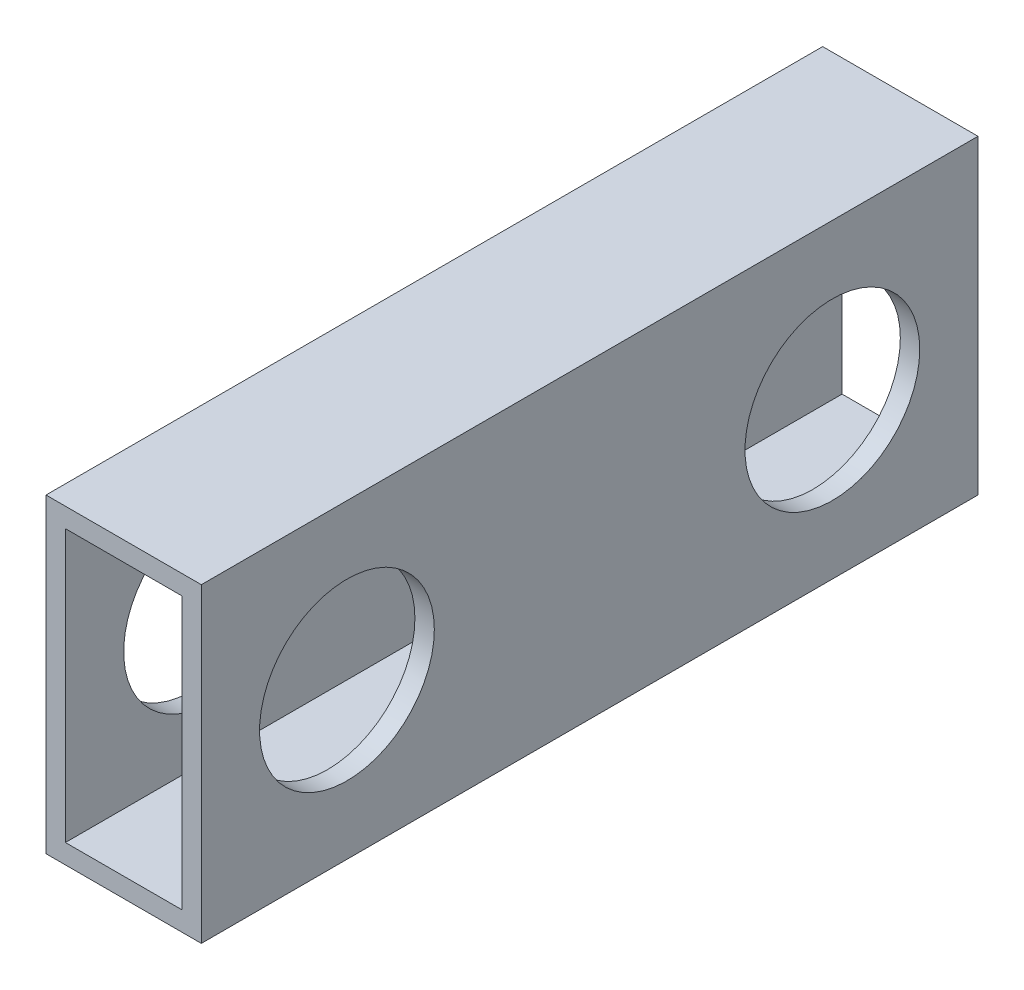
from build123d import *

# Parameters (mm, degrees)
SKETCH1_W           = 25.4
SKETCH1_H           = 50.8
BOSS_EXTRUDE1_DEPTH = 63.5
SHELL2_T            = -3.175
SKETCH2_R           = 14.2875
CUT_EXTRUDE1_DEPTH  = 73.955945611


with BuildPart() as part:
    # Sketch1 → Boss-Extrude1 (new, symmetric)
    with BuildSketch(Plane.XY):
        Rectangle(SKETCH1_W, SKETCH1_H)
    extrude(amount=BOSS_EXTRUDE1_DEPTH, both=True)

    # Shell2
    shell2_openings = [part.faces().sort_by_distance(p)[0] for p in [
        (0, 0, 63.5),
        (0, 0, -63.5),
    ]]
    offset(amount=SHELL2_T, openings=shell2_openings, kind=Kind.INTERSECTION)

    # Sketch2 → Cut-Extrude1 (cut, through all)
    with BuildSketch(Plane(origin=(12.7, 0, 0), x_dir=(0, 0, -1), z_dir=(1, 0, 0))):
        with Locations((39.6875, 0)):
            Circle(SKETCH2_R)
        with Locations((-39.6875, 0)):
            Circle(SKETCH2_R)
    extrude(amount=-CUT_EXTRUDE1_DEPTH, mode=Mode.SUBTRACT)


solid = part.part
